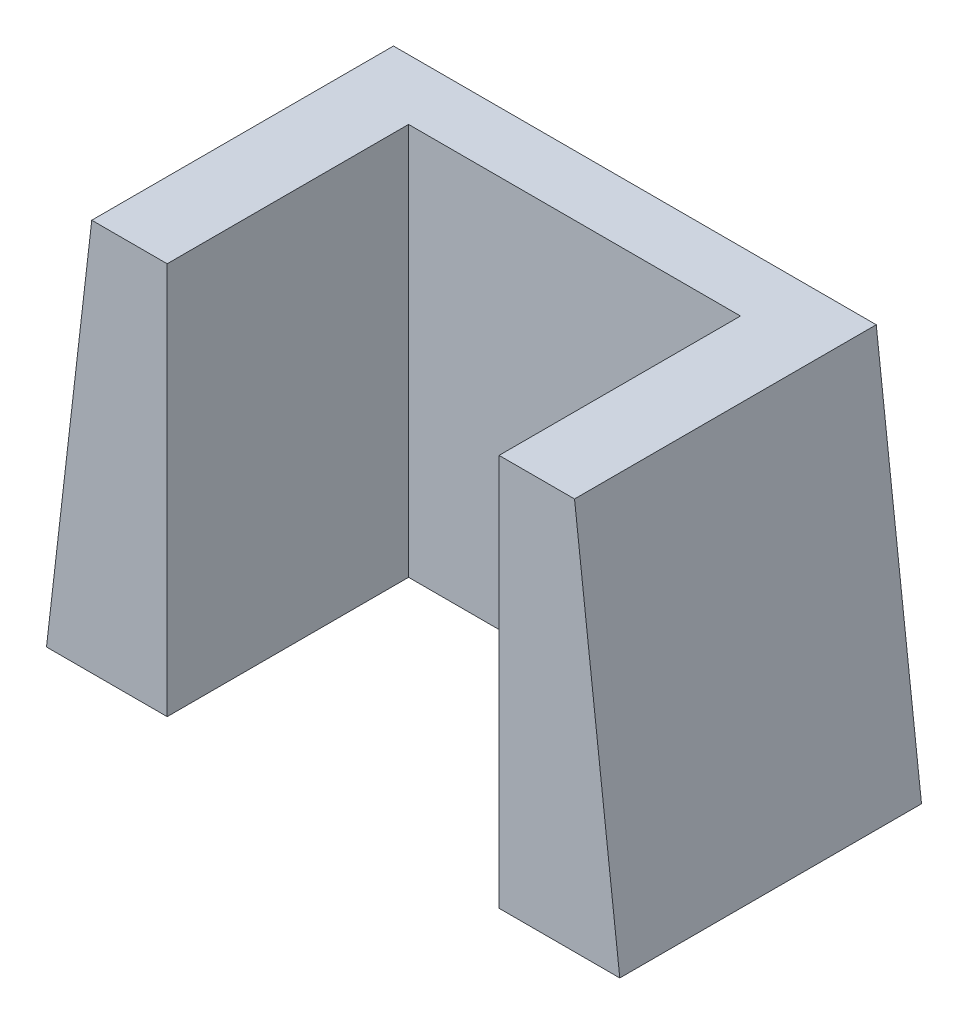
from build123d import *

# Parameters (mm, degrees)
EXTRUDE_1_DEPTH     = 10
SKETCH_2_W          = 11
SKETCH_2_H          = 8
CUT_EXTRUDE_1_DEPTH = 19.953891421


with BuildPart() as part:
    # Эскиз1 → Бобышка-Вытянуть1 (new body)
    with BuildSketch(Plane.XY):
        Polygon((-9.5, 0), (9.5, 0), (8, 13), (-8, 13), align=None)
    extrude(amount=EXTRUDE_1_DEPTH)

    # Эскиз2 → Вырез-Вытянуть1 (cut, through all)
    with BuildSketch(Plane(origin=(0, 13, 0), x_dir=(1, 0, 0), z_dir=(0, 1, 0))):
        with Locations((0, -6)):
            Rectangle(SKETCH_2_W, SKETCH_2_H)
    extrude(amount=-CUT_EXTRUDE_1_DEPTH, mode=Mode.SUBTRACT)


solid = part.part
